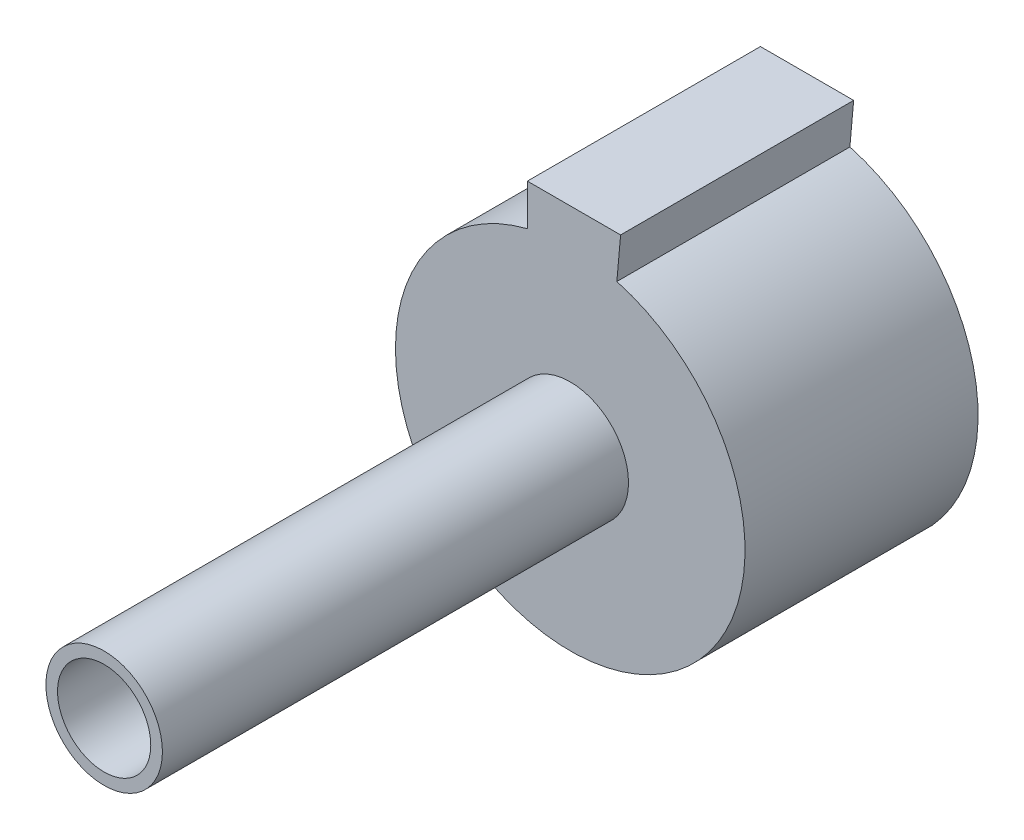
from build123d import *

# Parameters (mm, degrees)
BOSS_EXTRUDE2_DEPTH = 20
SKETCH2_R           = 5
BOSS_EXTRUDE3_DEPTH = 40
SKETCH8_R           = 4
CUT_EXTRUDE1_DEPTH  = 40


with BuildPart() as part:
    # Sketch1 → Boss-Extrude2 (new body)
    with BuildSketch(Plane.XY):
        with BuildLine():
            Line((-3.678627735, 14.541928964), (-3.678627735, 18.081928964))
            Line((-3.678627735, 18.081928964), (4.321372265, 18.081928964))
            Line((4.321372265, 18.081928964), (4, 14.456832295))
            ThreePointArc((4, 14.456832295), (-0.166223927, -14.999078959), (-3.678627735, 14.541928964))
        make_face()
    extrude(amount=BOSS_EXTRUDE2_DEPTH)

    # Sketch2 → Boss-Extrude3 (add)
    with BuildSketch(Plane.XY.offset(20)):
        Circle(SKETCH2_R)
    extrude(amount=BOSS_EXTRUDE3_DEPTH)

    # Sketch8 → Cut-Extrude1 (cut)
    with BuildSketch(Plane.XY.offset(60)):
        Circle(SKETCH8_R)
    extrude(amount=-CUT_EXTRUDE1_DEPTH, mode=Mode.SUBTRACT)


solid = part.part
